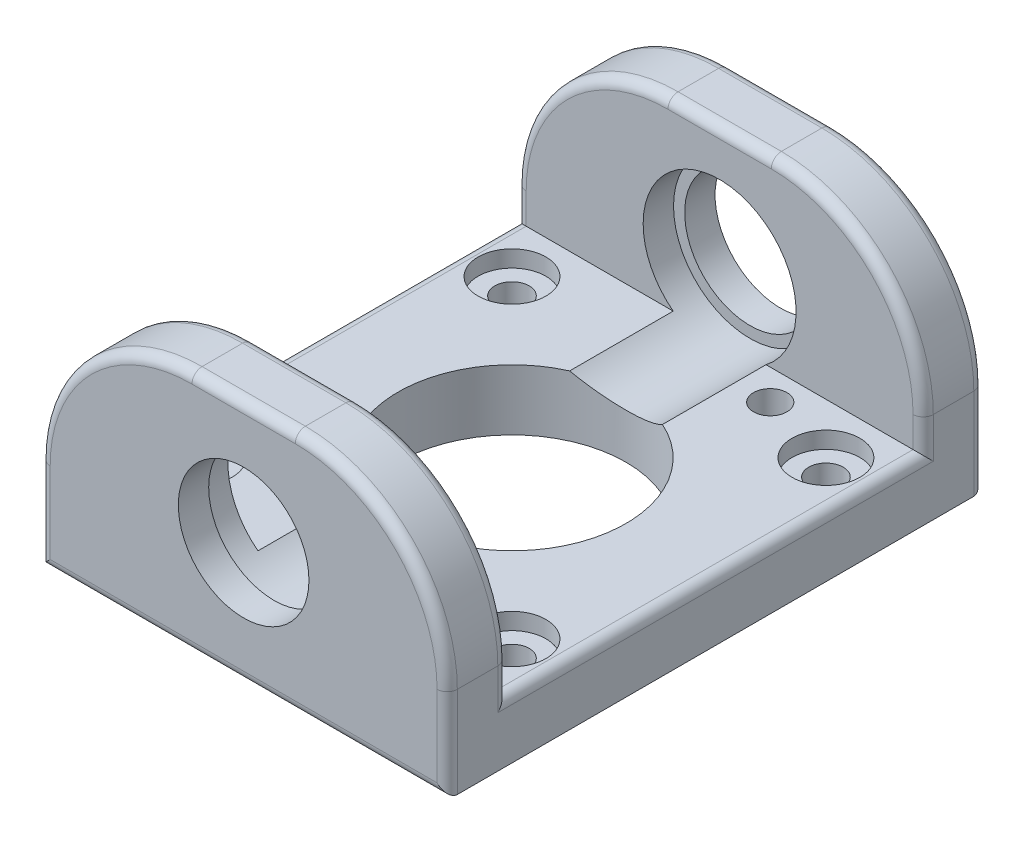
from build123d import *

# Parameters (mm, degrees)
SKETCH1_W                       = 40.2
SKETCH1_H                       = 53
SKETCH1_R                       = 11.25
BOSS_EXTRUDE1_DEPTH             = 6
CBORE_FOR_M3_SBHCS1_D           = 3.4
CBORE_FOR_M3_SBHCS1_CBORE_D     = 6.7
CBORE_FOR_M3_SBHCS1_CBORE_DEPTH = 1.65
SKETCH5_W                       = 40.2
SKETCH5_H                       = 6
BOSS_EXTRUDE2_DEPTH             = 18
CUT_EXTRUDE1_REACH              = 61.473
SKETCH6_R                       = 6.45
FILLET3_R                       = 15
SKETCH8_R                       = 7.55
CUT_EXTRUDE3_DEPTH              = 3
CUT_EXTRUDE3_DIRECTION_2_REACH  = 56.194
FILLET3_OF_MIRROR1_R            = 15
FILLET4_R                       = 1
M4X0_7_TAPPED_HOLE1_D           = 3.3


with BuildPart() as part:
    # Sketch1 → Boss-Extrude1 (new body)
    with BuildSketch(Plane(origin=(0, 0, 0), x_dir=(1, 0, 0), z_dir=(0, 1, 0))):
        Rectangle(SKETCH1_W, SKETCH1_H)
        with Locations(Location((0, 0, 0), (0, 0, 270))):
            Circle(SKETCH1_R, mode=Mode.SUBTRACT)
    extrude(amount=-BOSS_EXTRUDE1_DEPTH)

    # CBORE for M3 SBHCS1 (through all)
    with Locations(Plane(origin=(0, 0, 0), x_dir=(1, 0, 0), z_dir=(0, 1, 0))):
        with Locations((-15.5, 15.5), (15.5, 15.5), (15.5, -15.5), (-15.5, -15.5)):
            CounterBoreHole(CBORE_FOR_M3_SBHCS1_D / 2, CBORE_FOR_M3_SBHCS1_CBORE_D / 2, CBORE_FOR_M3_SBHCS1_CBORE_DEPTH)

    # Sketch5 → Boss-Extrude2 (add)
    with BuildSketch(Plane(origin=(0, 0, 0), x_dir=(1, 0, 0), z_dir=(0, 1, 0))):
        with Locations((0, -23.5)):
            Rectangle(SKETCH5_W, SKETCH5_H)
    boss_extrude2 = extrude(amount=BOSS_EXTRUDE2_DEPTH)

    # Sketch6 → Cut-Extrude1 (cut, up to next)
    with BuildSketch(Plane.XY.offset(26.5), mode=Mode.PRIVATE) as cut_extrude1_sk1:
        with Locations((0, 6)):
            Circle(SKETCH6_R)
    cut_extrude1_tool1 = extrude(cut_extrude1_sk1.sketch, amount=-CUT_EXTRUDE1_REACH, mode=Mode.PRIVATE) & part.part
    cut_extrude1 = cut_extrude1_tool1.solids().sort_by_distance((0, 6, 26.5))[0]
    add(cut_extrude1, mode=Mode.SUBTRACT)

    # Fillet3
    fillet3_edges = [part.edges().sort_by_distance(p)[0] for p in [
        (20.1, 18, 23.5),
        (-20.1, 18, 23.5),
    ]]
    fillet(fillet3_edges, radius=FILLET3_R)

    # Sketch8 → Cut-Extrude3 (cut)
    with BuildSketch(Plane(origin=(0, 0, 20.5), x_dir=(-1, 0, 0), z_dir=(0, 0, -1))):
        with Locations(Location((0, 6, 0), (0, 0, 232.627116603))):
            Circle(SKETCH8_R)
    cut_extrude3 = extrude(amount=-CUT_EXTRUDE3_DEPTH, mode=Mode.SUBTRACT)

    # Sketch8 → Cut-Extrude3 direction 2 (cut, up to next)
    with BuildSketch(Plane(origin=(0, 0, 20.5), x_dir=(-1, 0, 0), z_dir=(0, 0, -1)), mode=Mode.PRIVATE) as cut_extrude3_direction_2_sk1:
        with Locations(Location((0, 6, 0), (0, 0, 232.627116603))):
            Circle(SKETCH8_R)
    cut_extrude3_direction_2_tool1 = extrude(cut_extrude3_direction_2_sk1.sketch, amount=CUT_EXTRUDE3_DIRECTION_2_REACH, mode=Mode.PRIVATE) & part.part
    cut_extrude3_direction_2 = cut_extrude3_direction_2_tool1.solids().sort_by_distance((0, 6, 20.5))[0]
    add(cut_extrude3_direction_2, mode=Mode.SUBTRACT)

    # Mirror1: Boss-Extrude2, Cut-Extrude1, Cut-Extrude3, Cut-Extrude3 direction 2 across plane
    add(boss_extrude2.mirror(Plane.XY))
    add(cut_extrude1.mirror(Plane.XY), mode=Mode.SUBTRACT)
    add(cut_extrude3.mirror(Plane.XY), mode=Mode.SUBTRACT)
    add(cut_extrude3_direction_2.mirror(Plane.XY), mode=Mode.SUBTRACT)

    # Fillet3 of Mirror1
    fillet3_of_mirror1_edges = [part.edges().sort_by_distance(p)[0] for p in [
        (20.1, 18, -23.5),
        (-20.1, 18, -23.5),
    ]]
    fillet(fillet3_of_mirror1_edges, radius=FILLET3_OF_MIRROR1_R)

    # Fillet4
    fillet4_edges = [part.edges().sort_by_distance(p)[0] for p in [
        (20.1, 1.5, 20.5),
        (15.706601718, 13.606601718, 20.5),
        (0, 18, 20.5),
        (-15.706601718, 13.606601718, 20.5),
        (20.1, 1.5, -20.5),
        (15.706601718, 13.606601718, -20.5),
        (0, 18, -20.5),
        (-15.706601718, 13.606601718, -20.5),
        (20.1, -1.5, -26.5),
        (15.706601718, 13.606601718, -26.5),
        (0, 18, -26.5),
        (-15.706601718, 13.606601718, -26.5),
        (20.1, -1.5, 26.5),
        (15.706601718, 13.606601718, 26.5),
        (0, 18, 26.5),
        (-15.706601718, 13.606601718, 26.5),
        (20.1, 0, 0),
        (-20.1, 0, 0),
        (0, -6, 26.5),
        (0, -6, -26.5),
        (-20.1, 1.5, 20.5),
        (-20.1, 1.5, -20.5),
        (-20.1, -1.5, -26.5),
        (-20.1, -1.5, 26.5),
    ]]
    fillet(fillet4_edges, radius=FILLET4_R)

    # M4x0.7 Tapped Hole1 (through all)
    with Locations(Plane(origin=(0, -6, 0), x_dir=(-1, 0, 0), z_dir=(0, -1, 0))):
        with Locations((-8, 17.5), (-8, -17.5)):
            Hole(M4X0_7_TAPPED_HOLE1_D / 2)


solid = part.part
